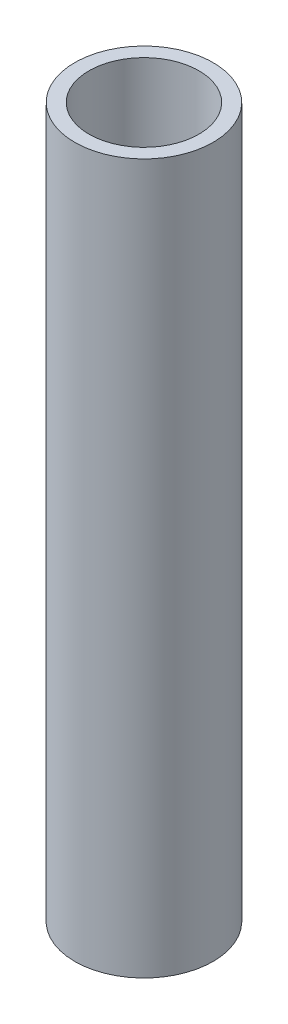
from build123d import *

# Parameters (mm, degrees)
SKETCH_1_R      = 1.95
SKETCH_1_R_2    = 1.55
EXTRUDE_1_DEPTH = 20


with BuildPart() as part:
    # 草圖1 → 填料-伸長1 (new body)
    with BuildSketch(Plane(origin=(0, 0, 0), x_dir=(1, 0, 0), z_dir=(0, 1, 0))):
        with Locations(Location((0, 0, 0), (0, 0, 270))):
            Circle(SKETCH_1_R)
        with Locations(Location((0, 0, 0), (0, 0, 270))):
            Circle(SKETCH_1_R_2, mode=Mode.SUBTRACT)
    extrude(amount=EXTRUDE_1_DEPTH)


solid = part.part
